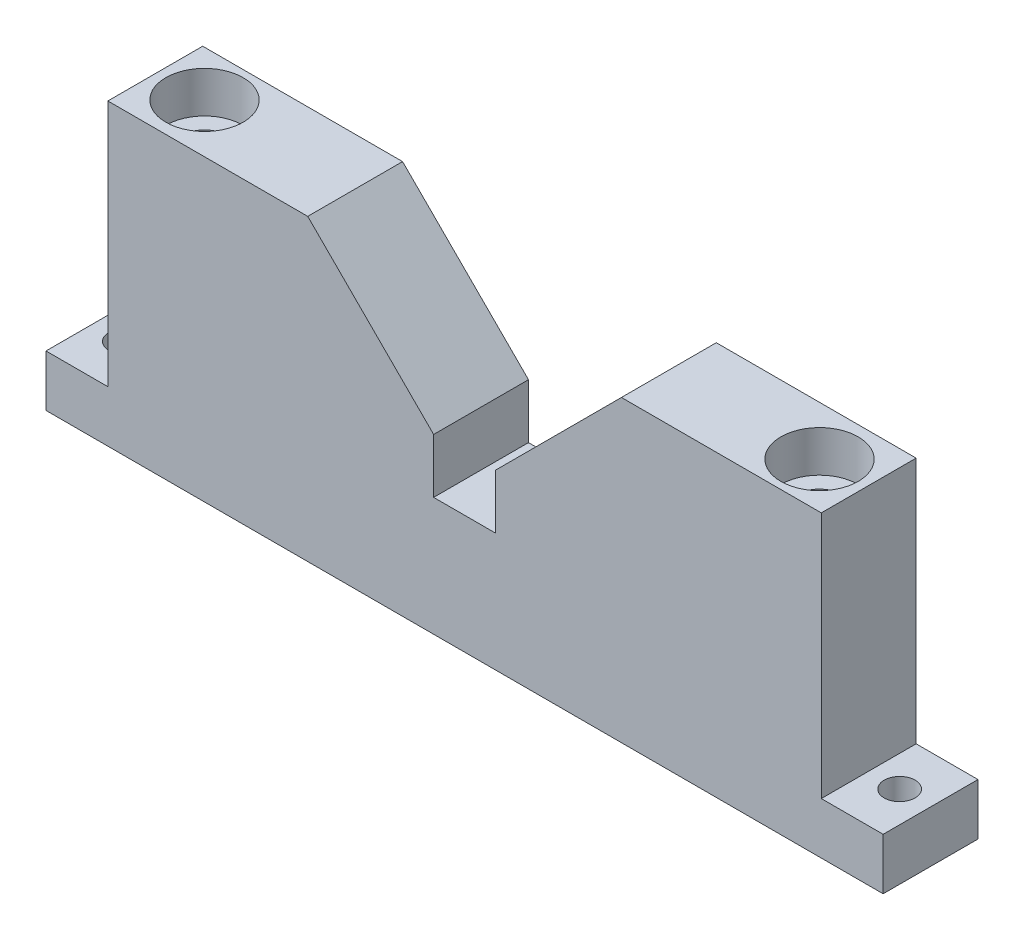
from build123d import *

# Parameters (mm, degrees)
EXTRUDE_1_DEPTH             = 9.2
SKETCH_2_W                  = 162.4
SKETCH_2_H                  = 18.4
EXTRUDE_2_DEPTH             = 10
HOLE_WIZARD_M82_D           = 8.4
HOLE_WIZARD_M82_CBORE_D     = 15
HOLE_WIZARD_M82_CBORE_DEPTH = 8
HOLE_WIZARD_6_0_6_2_D       = 6


with BuildPart() as part:
    # Эскиз1 → Бобышка-Вытянуть1 (new, symmetric)
    with BuildSketch(Plane.XY):
        Polygon((-69.2, -12), (-30.426406871, -12), (-6, -36.426406871), (-6, -47), (6, -47), (6, -36.426406871), (30.426406871, -12), (69.2, -12), (69.2, -60), (-69.2, -60), align=None)
    extrude(amount=EXTRUDE_1_DEPTH, both=True)

    # Эскиз2 → Бобышка-Вытянуть2 (add)
    with BuildSketch(Plane.XZ.offset(60)):
        Rectangle(SKETCH_2_W, SKETCH_2_H)
    extrude(amount=EXTRUDE_2_DEPTH)

    # Цековка для винта с внутренним шестигранником M82 (through all)
    with Locations(Plane(origin=(0, -12, 0), x_dir=(-1, 0, 0), z_dir=(0, 1, 0))):
        with Locations((-60, 0.343824936), (60, -0.343824936)):
            CounterBoreHole(HOLE_WIZARD_M82_D / 2, HOLE_WIZARD_M82_CBORE_D / 2, HOLE_WIZARD_M82_CBORE_DEPTH)

    # Диаметр отверстия Ø6.0 (6)2 (through all)
    with Locations(Plane(origin=(0, -60, 0), x_dir=(-1, 0, 0), z_dir=(0, 1, 0))):
        with Locations((-75.2, 0), (75.2, 0)):
            Hole(HOLE_WIZARD_6_0_6_2_D / 2)


solid = part.part
